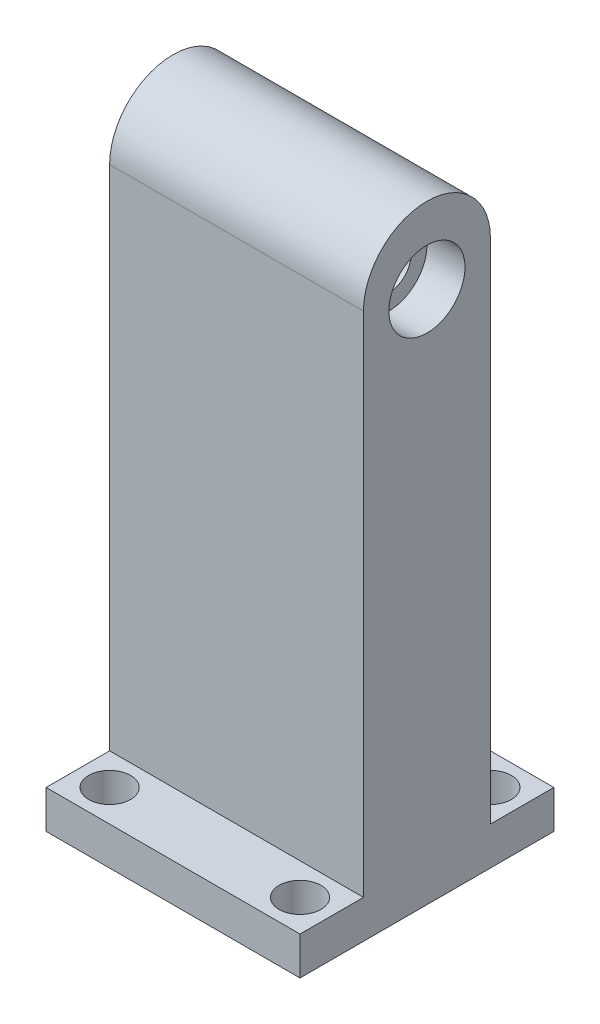
from build123d import *

# Parameters (mm, degrees)
SKETCH1_W           = 20
SKETCH1_H           = 20
BOSS_EXTRUDE1_DEPTH = 52
SKETCH2_R           = 3
CUT_EXTRUDE1_DEPTH  = 3
SKETCH3_R           = 1.75
CUT_EXTRUDE2_DEPTH  = 56.614746246
CUT_EXTRUDE3_START  = -3
SKETCH4_R           = 3
CUT_EXTRUDE3_DEPTH  = 3
SKETCH5_R           = 1.649559613
CUT_EXTRUDE4_DEPTH  = 54.888774341
CUT_EXTRUDE5_DEPTH  = 57.603886792


with BuildPart() as part:
    # Sketch1 → Boss-Extrude1 (new body)
    with BuildSketch(Plane(origin=(0, 0, 0), x_dir=(1, 0, 0), z_dir=(0, 1, 0))):
        Rectangle(SKETCH1_W, SKETCH1_H)
    extrude(amount=BOSS_EXTRUDE1_DEPTH)

    # Sketch2 → Cut-Extrude1 (cut)
    with BuildSketch(Plane(origin=(10, 0, 0), x_dir=(0, 0, -1), z_dir=(1, 0, 0))):
        with Locations((0, 42)):
            Circle(SKETCH2_R)
    extrude(amount=-CUT_EXTRUDE1_DEPTH, mode=Mode.SUBTRACT)

    # Sketch3 → Cut-Extrude2 (cut, through all)
    with BuildSketch(Plane(origin=(7, 0, 0), x_dir=(0, 0, -1), z_dir=(1, 0, 0))):
        with Locations((0, 42)):
            Circle(SKETCH3_R)
    extrude(amount=-CUT_EXTRUDE2_DEPTH, mode=Mode.SUBTRACT)

    # Sketch4 → Cut-Extrude3 (cut)
    with BuildSketch(Plane.ZY.offset(10).offset(CUT_EXTRUDE3_START)):
        with Locations(Location((0, 42, 0), (0, 0, 180))):
            Circle(SKETCH4_R)
    extrude(amount=CUT_EXTRUDE3_DEPTH, mode=Mode.SUBTRACT)

    # Sketch5 → Cut-Extrude4 (cut, through all)
    with BuildSketch(Plane(origin=(0, 52, 0), x_dir=(1, 0, 0), z_dir=(0, 1, 0))):
        with Locations(Location((-7.5, 7.5, 0), (0, 0, 270))):
            Circle(SKETCH5_R)
        with Locations(Location((7.5, 7.5, 0), (0, 0, 270))):
            Circle(SKETCH5_R)
        with Locations(Location((7.5, -7.5, 0), (0, 0, 270))):
            Circle(SKETCH5_R)
        with Locations(Location((-7.5, -7.5, 0), (0, 0, 270))):
            Circle(SKETCH5_R)
    extrude(amount=-CUT_EXTRUDE4_DEPTH, mode=Mode.SUBTRACT)

    # Sketch6 → Cut-Extrude5 (cut, through all)
    with BuildSketch(Plane.ZY.offset(10)):
        with BuildLine():
            Line((-10, 3), (-5, 3))
            Line((-5, 3), (-5, 43))
            ThreePointArc((-5, 43), (0, 48), (5, 43))
            Line((5, 43), (5, 3))
            Line((5, 3), (10, 3))
            Line((10, 3), (10, 52))
            Line((10, 52), (-10, 52))
            Line((-10, 52), (-10, 3))
        make_face()
    extrude(amount=-CUT_EXTRUDE5_DEPTH, mode=Mode.SUBTRACT)


solid = part.part
